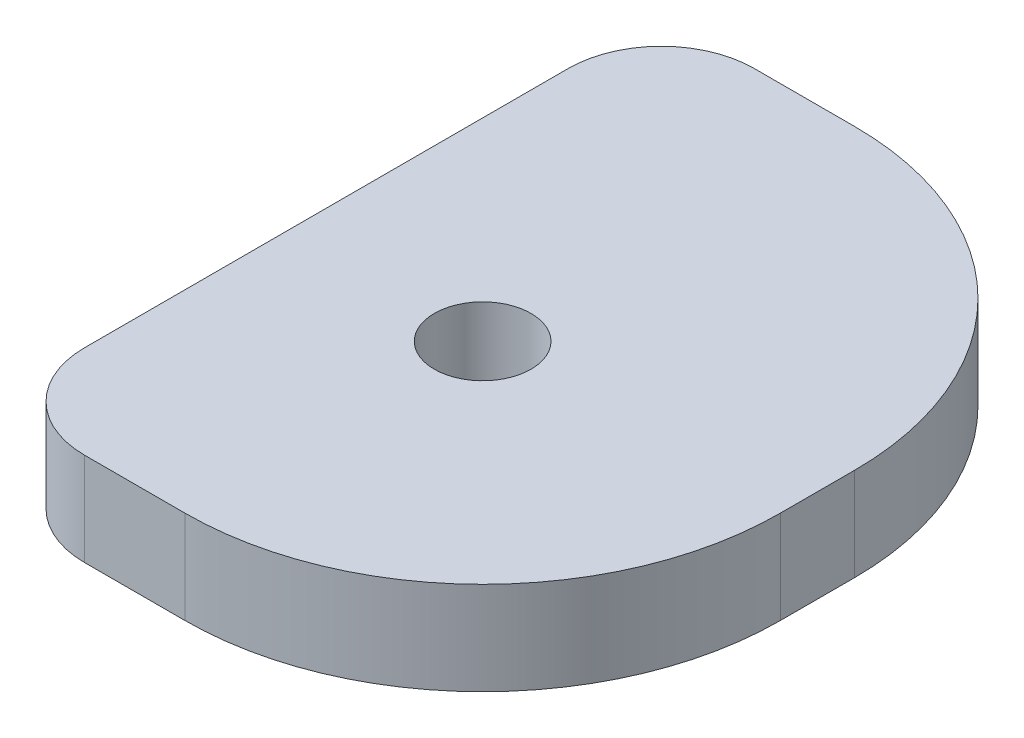
from build123d import *

# Parameters (mm, degrees)
SKETCH1_W           = 50.8
SKETCH1_H           = 22.86
BOSS_EXTRUDE1_DEPTH = 3.175
FILLET1_R           = 10.16
SKETCH3_R           = 1.651
CUT_EXTRUDE1_DEPTH  = 29.033649869
FILLET3_R           = 10.16
SKETCH4_W           = 34.036
SKETCH4_H           = 22.86
CUT_EXTRUDE2_DEPTH  = 29.033649869
FILLET4_R           = 3.175


with BuildPart() as part:
    # Sketch1 → Boss-Extrude1 (new body)
    with BuildSketch(Plane(origin=(0, 0, 0), x_dir=(1, 0, 0), z_dir=(0, 1, 0))):
        Rectangle(SKETCH1_W, SKETCH1_H)
    extrude(amount=BOSS_EXTRUDE1_DEPTH)

    # Fillet1
    fillet1_edges = [part.edges().sort_by_distance(p)[0] for p in [
        (25.4, 1.5875, 11.43),
        (-25.4, 1.5875, 11.43),
    ]]
    fillet(fillet1_edges, radius=FILLET1_R)

    # Sketch3 → Cut-Extrude1 (cut, through all)
    with BuildSketch(Plane(origin=(0, 3.175, 0), x_dir=(1, 0, 0), z_dir=(0, 1, 0))):
        with Locations(Location((15.24, -1.27, 0), (0, 0, 270))):
            Circle(SKETCH3_R)
        with Locations(Location((-3.81, -1.27, 0), (0, 0, 270))):
            Circle(SKETCH3_R)
    extrude(amount=-CUT_EXTRUDE1_DEPTH, mode=Mode.SUBTRACT)

    # Fillet3
    fillet3_edges = [part.edges().sort_by_distance(p)[0] for p in [
        (-25.4, 1.5875, -11.43),
        (25.4, 1.5875, -11.43),
    ]]
    fillet(fillet3_edges, radius=FILLET3_R)

    # Sketch4 → Cut-Extrude2 (cut, through all)
    with BuildSketch(Plane(origin=(0, 0, 0), x_dir=(-1, 0, 0), z_dir=(0, -1, 0))):
        with Locations((8.382, 0)):
            Rectangle(SKETCH4_W, SKETCH4_H)
    extrude(amount=-CUT_EXTRUDE2_DEPTH, mode=Mode.SUBTRACT)

    # Fillet4
    fillet4_edges = [part.edges().sort_by_distance(p)[0] for p in [
        (8.636, 1.5875, -11.43),
        (8.636, 1.5875, 11.43),
    ]]
    fillet(fillet4_edges, radius=FILLET4_R)


solid = part.part
